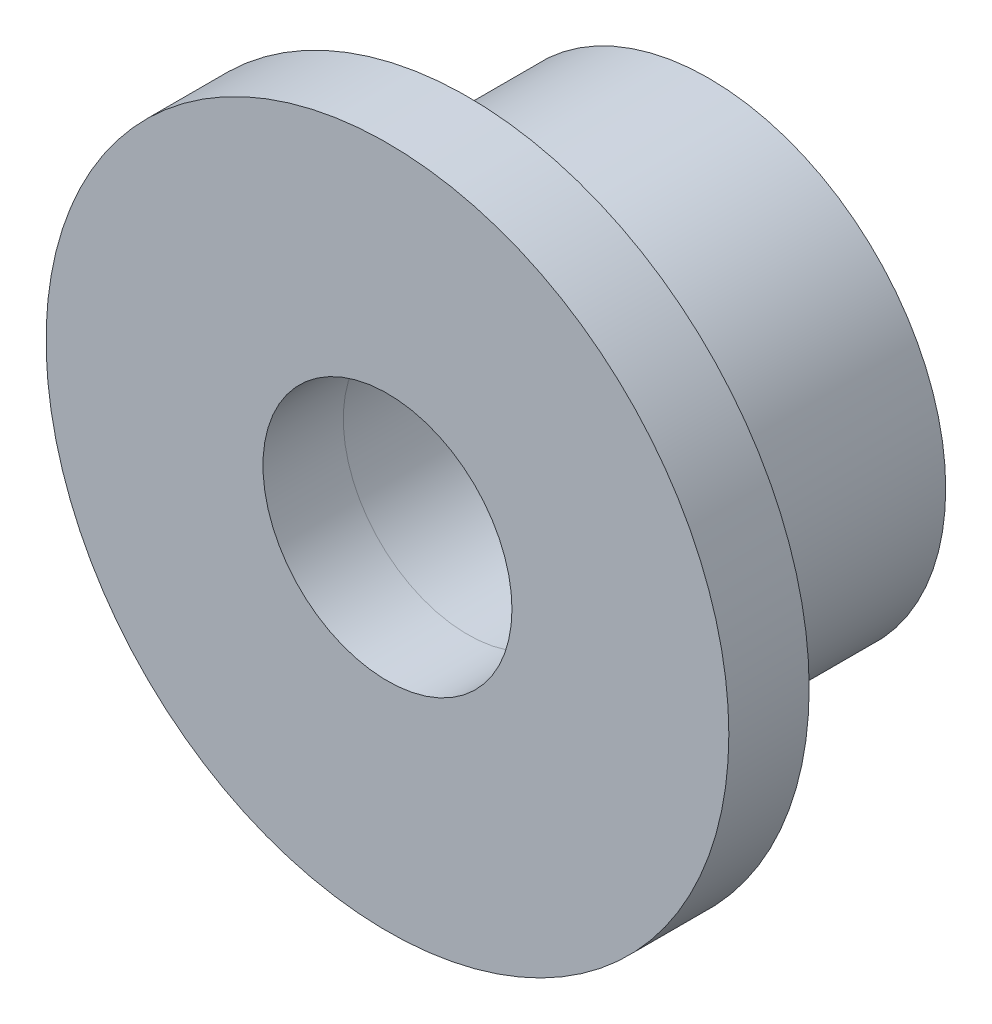
from build123d import *

# Parameters (mm, degrees)
CROQUIS1_R              = 2.95
CROQUIS1_R_2            = 1.55
SALIENTE_EXTRUIR1_DEPTH = 3
CROQUIS2_R              = 4.25
CROQUIS2_R_2            = 1.55
SALIENTE_EXTRUIR2_DEPTH = 1


with BuildPart() as part:
    # Croquis1 → Saliente-Extruir1 (new body)
    with BuildSketch(Plane.XY):
        Circle(CROQUIS1_R)
        Circle(CROQUIS1_R_2, mode=Mode.SUBTRACT)
    extrude(amount=SALIENTE_EXTRUIR1_DEPTH)


with BuildPart() as body_2:
    # Croquis2 → Saliente-Extruir2 (new body)
    with BuildSketch(Plane.XY.offset(3)):
        Circle(CROQUIS2_R)
        Circle(CROQUIS2_R_2, mode=Mode.SUBTRACT)
    extrude(amount=SALIENTE_EXTRUIR2_DEPTH)


solid = Compound([part.part, body_2.part])
